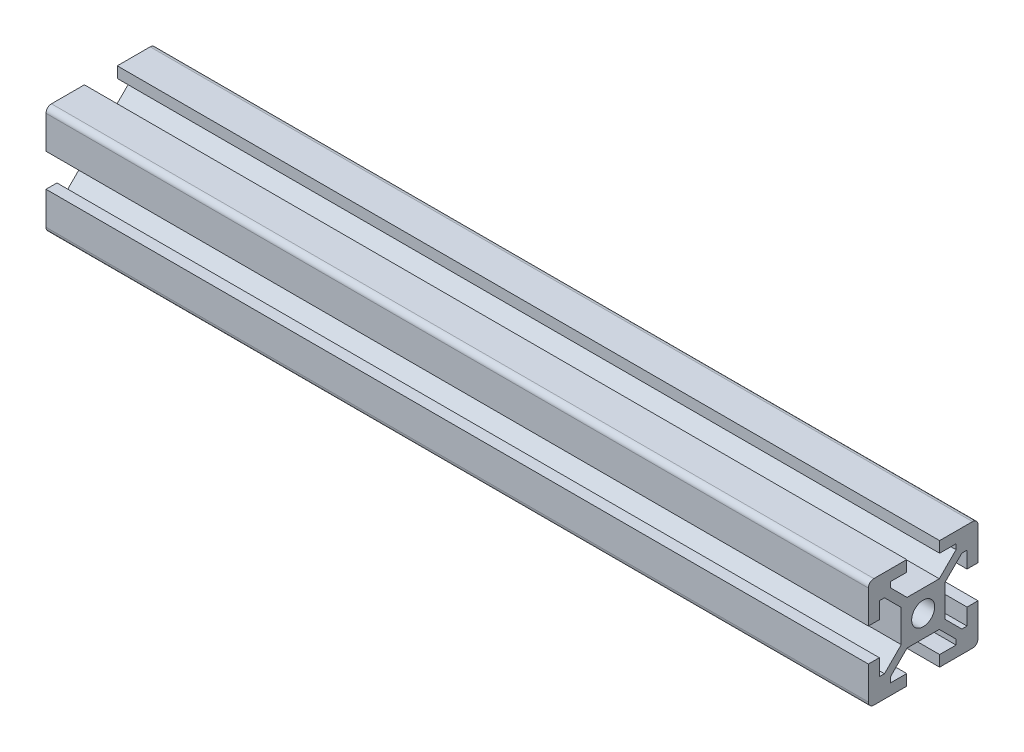
from build123d import *

# Parameters (mm, degrees)
SKETCH1_R           = 2.1
BOSS_EXTRUDE1_DEPTH = 150


with BuildPart() as part:
    # Sketch1 → Boss-Extrude1 (new body)
    with BuildSketch(Plane(origin=(0, 0, 0), x_dir=(0, 0, -1), z_dir=(1, 0, 0))):
        with BuildLine():
            Line((-10, 9), (-10, 3))
            Line((-10, 3), (-8, 3))
            Line((-8, 3), (-8, 6))
            Line((-8, 6), (-7.060660172, 6))
            Line((-7.060660172, 6), (-4, 2.939339828))
            Line((-4, 2.939339828), (-4, -2.939339828))
            Line((-4, -2.939339828), (-7.060660172, -6))
            Line((-7.060660172, -6), (-8, -6))
            Line((-8, -6), (-8, -3))
            Line((-8, -3), (-10, -3))
            Line((-10, -3), (-10, -9))
            ThreePointArc((-10, -9), (-9.707106781, -9.707106781), (-9, -10))
            Line((-9, -10), (-3, -10))
            Line((-3, -10), (-3, -8))
            Line((-3, -8), (-6, -8))
            Line((-6, -8), (-6, -7.060660172))
            Line((-6, -7.060660172), (-2.939339828, -4))
            Line((-2.939339828, -4), (2.939339828, -4))
            Line((2.939339828, -4), (6, -7.060660172))
            Line((6, -7.060660172), (6, -8))
            Line((6, -8), (3, -8))
            Line((3, -8), (3, -10))
            Line((3, -10), (9, -10))
            ThreePointArc((9, -10), (9.707106781, -9.707106781), (10, -9))
            Line((10, -9), (10, -3))
            Line((10, -3), (8, -3))
            Line((8, -3), (8, -6))
            Line((8, -6), (7.060660172, -6))
            Line((7.060660172, -6), (4, -2.939339828))
            Line((4, -2.939339828), (4, 2.939339828))
            Line((4, 2.939339828), (7.060660172, 6))
            Line((7.060660172, 6), (8, 6))
            Line((8, 6), (8, 3))
            Line((8, 3), (10, 3))
            Line((10, 3), (10, 9))
            ThreePointArc((10, 9), (9.707106781, 9.707106781), (9, 10))
            Line((9, 10), (3, 10))
            Line((3, 10), (3, 8))
            Line((3, 8), (6, 8))
            Line((6, 8), (6, 7.060660172))
            Line((6, 7.060660172), (2.939339828, 4))
            Line((2.939339828, 4), (-2.939339828, 4))
            Line((-2.939339828, 4), (-6, 7.060660172))
            Line((-6, 7.060660172), (-6, 8))
            Line((-6, 8), (-3, 8))
            Line((-3, 8), (-3, 10))
            Line((-3, 10), (-9, 10))
            ThreePointArc((-9, 10), (-9.707106781, 9.707106781), (-10, 9))
        make_face()
        Circle(SKETCH1_R, mode=Mode.SUBTRACT)
    extrude(amount=BOSS_EXTRUDE1_DEPTH)


solid = part.part
